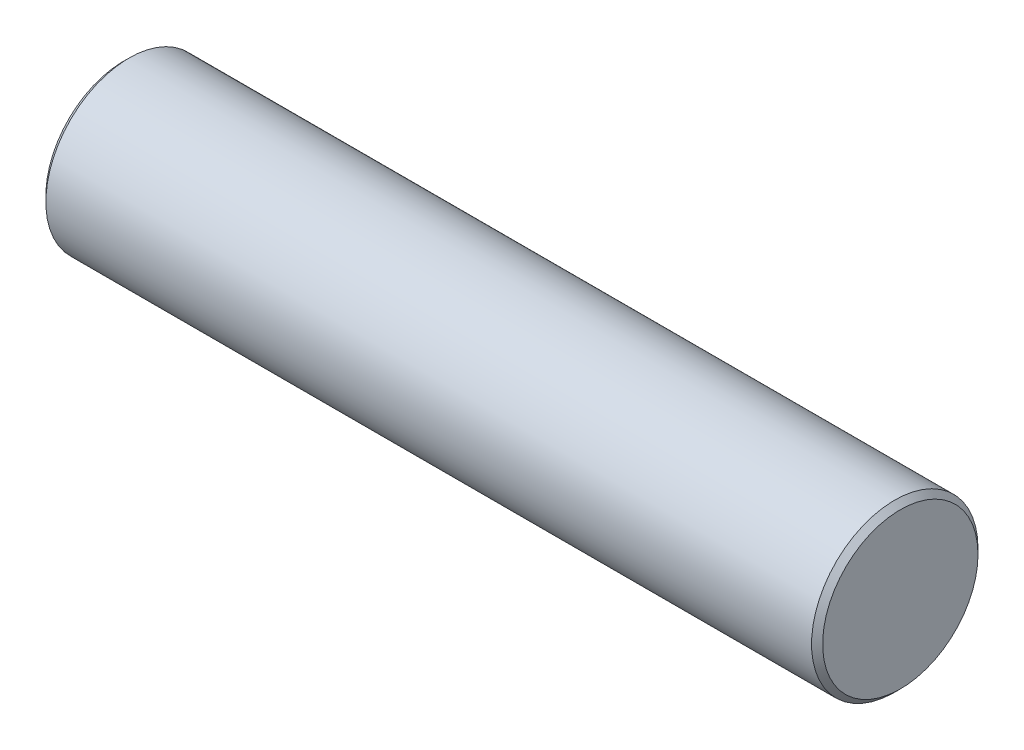
from build123d import *

# Parameters (mm, degrees)
SKETCH1_R           = 1.5
BOSS_EXTRUDE1_DEPTH = 14
CHAMFER1_SIZE       = 0.1


with BuildPart() as part:
    # Sketch1 → Boss-Extrude1 (new body)
    with BuildSketch(Plane(origin=(0, 0, 0), x_dir=(0, 0, -1), z_dir=(1, 0, 0))):
        Circle(SKETCH1_R)
    extrude(amount=BOSS_EXTRUDE1_DEPTH)

    # Chamfer1
    chamfer1_edges = [part.edges().sort_by_distance(p)[0] for p in [
        (0, 0, 1.5),
        (14, 0, 1.5),
    ]]
    chamfer(chamfer1_edges, length=CHAMFER1_SIZE)


solid = part.part
